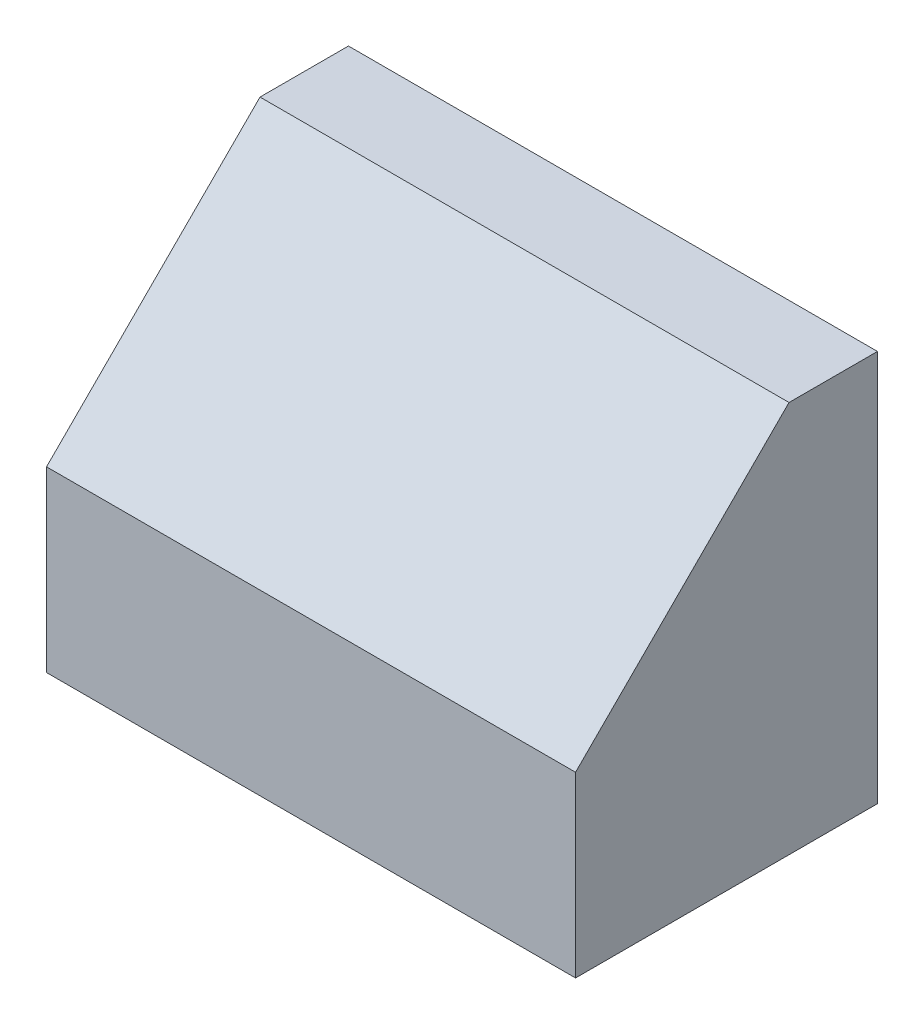
from build123d import *

# Parameters (mm, degrees)
SKIZZE1_W                       = 155.6
SKIZZE1_H                       = 115.2
AUFSATZ_LINEAR_AUSTRAGEN1_DEPTH = 88.8
SCHNITT_LINEAR_AUSTRAGEN1_DEPTH = 189.187566008


with BuildPart() as part:
    # Skizze1 → Aufsatz-Linear austragen1 (new body)
    with BuildSketch(Plane.XY):
        Rectangle(SKIZZE1_W, SKIZZE1_H)
    extrude(amount=AUFSATZ_LINEAR_AUSTRAGEN1_DEPTH)

    # Skizze6 → Schnitt-Linear austragen1 (cut, through all)
    with BuildSketch(Plane.ZY.offset(77.8)):
        Polygon((26.008917831, 57.6), (88.8, -5.191082169), (88.8, 57.6), align=None)
    extrude(amount=-SCHNITT_LINEAR_AUSTRAGEN1_DEPTH, mode=Mode.SUBTRACT)


solid = part.part
